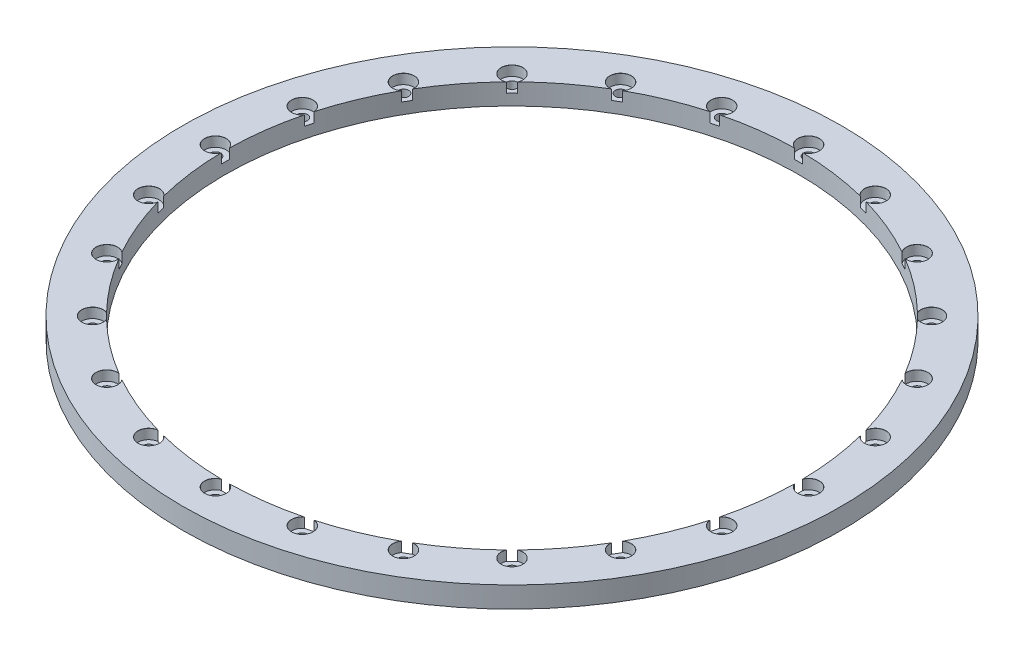
from build123d import *

# Parameters (mm, degrees)
SKETCH1_R                      = 100
SKETCH1_R_2                    = 87
BOSS_EXTRUDE1_DEPTH            = 6.35
CBORE_FOR_M3_SHCS1_AT_2_COUNT  = 2
CBORE_FOR_M3_SHCS1_AT_2_PITCH  = 23.4947146
CBORE_FOR_M3_SHCS1_AT_3_COUNT  = 2
CBORE_FOR_M3_SHCS1_AT_3_PITCH  = 46.587428118
CBORE_FOR_M3_SHCS1_AT_4_COUNT  = 2
CBORE_FOR_M3_SHCS1_AT_4_PITCH  = 68.883017826
CBORE_FOR_M3_SHCS1_AT_5_COUNT  = 2
CBORE_FOR_M3_SHCS1_AT_5_PITCH  = 90
CBORE_FOR_M3_SHCS1_AT_6_COUNT  = 2
CBORE_FOR_M3_SHCS1_AT_6_PITCH  = 109.577057222
CBORE_FOR_M3_SHCS1_AT_7_COUNT  = 2
CBORE_FOR_M3_SHCS1_AT_7_PITCH  = 127.279220614
CBORE_FOR_M3_SHCS1_AT_8_COUNT  = 2
CBORE_FOR_M3_SHCS1_AT_8_PITCH  = 142.803601252
CBORE_FOR_M3_SHCS1_AT_9_COUNT  = 2
CBORE_FOR_M3_SHCS1_AT_9_PITCH  = 155.884572681
CBORE_FOR_M3_SHCS1_AT_10_COUNT = 2
CBORE_FOR_M3_SHCS1_AT_10_PITCH = 166.298315852
CBORE_FOR_M3_SHCS1_AT_11_COUNT = 2
CBORE_FOR_M3_SHCS1_AT_11_PITCH = 173.866648732
CBORE_FOR_M3_SHCS1_AT_12_COUNT = 2
CBORE_FOR_M3_SHCS1_AT_12_PITCH = 178.460075047
CBORE_FOR_M3_SHCS1_AT_13_COUNT = 2
CBORE_FOR_M3_SHCS1_AT_13_PITCH = 180
CBORE_FOR_M3_SHCS1_AT_14_COUNT = 2
CBORE_FOR_M3_SHCS1_AT_14_PITCH = 178.460075047
CBORE_FOR_M3_SHCS1_AT_15_COUNT = 2
CBORE_FOR_M3_SHCS1_AT_15_PITCH = 173.866648732
CBORE_FOR_M3_SHCS1_AT_16_COUNT = 2
CBORE_FOR_M3_SHCS1_AT_16_PITCH = 166.298315852
CBORE_FOR_M3_SHCS1_AT_17_COUNT = 2
CBORE_FOR_M3_SHCS1_AT_17_PITCH = 155.884572681
CBORE_FOR_M3_SHCS1_AT_18_COUNT = 2
CBORE_FOR_M3_SHCS1_AT_18_PITCH = 142.803601252
CBORE_FOR_M3_SHCS1_AT_19_COUNT = 2
CBORE_FOR_M3_SHCS1_AT_19_PITCH = 127.279220614
CBORE_FOR_M3_SHCS1_AT_20_COUNT = 2
CBORE_FOR_M3_SHCS1_AT_20_PITCH = 109.577057222
CBORE_FOR_M3_SHCS1_AT_21_COUNT = 2
CBORE_FOR_M3_SHCS1_AT_21_PITCH = 90
CBORE_FOR_M3_SHCS1_AT_22_COUNT = 2
CBORE_FOR_M3_SHCS1_AT_22_PITCH = 68.883017826
CBORE_FOR_M3_SHCS1_AT_23_COUNT = 2
CBORE_FOR_M3_SHCS1_AT_23_PITCH = 46.587428118
CBORE_FOR_M3_SHCS1_AT_24_COUNT = 2
CBORE_FOR_M3_SHCS1_AT_24_PITCH = 23.4947146


with BuildPart() as part:
    # Sketch1 → Boss-Extrude1 (new body)
    with BuildSketch(Plane(origin=(0, 0, 0), x_dir=(1, 0, 0), z_dir=(0, 1, 0))):
        with Locations(Location((0, 0, 0), (0, 0, 270))):
            Circle(SKETCH1_R)
        with Locations(Location((0, 0, 0), (0, 0, 270))):
            Circle(SKETCH1_R_2, mode=Mode.SUBTRACT)
    extrude(amount=BOSS_EXTRUDE1_DEPTH)

    # Sketch3 → CBORE for M3 SHCS1 (revolve, cut)
    with BuildSketch(Plane(origin=(90, 6.35, 0), x_dir=(0, 0, 1), z_dir=(1, 0, 0))):
        Polygon((0, 0), (0, 6.35), (1.6, 6.35), (1.6, 3), (3.25, 3), (3.25, 0.025), (3.275, 0), align=None)
    cbore_for_m3_shcs1 = revolve(axis=Axis((90, 12.7, 0), (0, -1, 0)), mode=Mode.SUBTRACT)

    # CBORE for M3 SHCS1 at 2: CBORE for M3 SHCS1 ×2
    with Locations(*[Vector(-0.13052619222005138, 0, 0.9914448613738105) * (i * CBORE_FOR_M3_SHCS1_AT_2_PITCH) for i in range(1, CBORE_FOR_M3_SHCS1_AT_2_COUNT)]):
        add(cbore_for_m3_shcs1, mode=Mode.SUBTRACT)

    # CBORE for M3 SHCS1 at 3: CBORE for M3 SHCS1 ×2
    with Locations(*[Vector(-0.25881904510252074, 0, 0.9659258262890683) * (i * CBORE_FOR_M3_SHCS1_AT_3_PITCH) for i in range(1, CBORE_FOR_M3_SHCS1_AT_3_COUNT)]):
        add(cbore_for_m3_shcs1, mode=Mode.SUBTRACT)

    # CBORE for M3 SHCS1 at 4: CBORE for M3 SHCS1 ×2
    with Locations(*[Vector(-0.3826834323650899, 0, 0.9238795325112867) * (i * CBORE_FOR_M3_SHCS1_AT_4_PITCH) for i in range(1, CBORE_FOR_M3_SHCS1_AT_4_COUNT)]):
        add(cbore_for_m3_shcs1, mode=Mode.SUBTRACT)

    # CBORE for M3 SHCS1 at 5: CBORE for M3 SHCS1 ×2
    with Locations(*[Vector(-0.5000000000000001, 0, 0.8660254037844386) * (i * CBORE_FOR_M3_SHCS1_AT_5_PITCH) for i in range(1, CBORE_FOR_M3_SHCS1_AT_5_COUNT)]):
        add(cbore_for_m3_shcs1, mode=Mode.SUBTRACT)

    # CBORE for M3 SHCS1 at 6: CBORE for M3 SHCS1 ×2
    with Locations(*[Vector(-0.6087614290087208, 0, 0.7933533402912352) * (i * CBORE_FOR_M3_SHCS1_AT_6_PITCH) for i in range(1, CBORE_FOR_M3_SHCS1_AT_6_COUNT)]):
        add(cbore_for_m3_shcs1, mode=Mode.SUBTRACT)

    # CBORE for M3 SHCS1 at 7: CBORE for M3 SHCS1 ×2
    with Locations(*[Vector(-0.7071067811865476, 0, 0.7071067811865475) * (i * CBORE_FOR_M3_SHCS1_AT_7_PITCH) for i in range(1, CBORE_FOR_M3_SHCS1_AT_7_COUNT)]):
        add(cbore_for_m3_shcs1, mode=Mode.SUBTRACT)

    # CBORE for M3 SHCS1 at 8: CBORE for M3 SHCS1 ×2
    with Locations(*[Vector(-0.7933533402912352, 0, 0.6087614290087207) * (i * CBORE_FOR_M3_SHCS1_AT_8_PITCH) for i in range(1, CBORE_FOR_M3_SHCS1_AT_8_COUNT)]):
        add(cbore_for_m3_shcs1, mode=Mode.SUBTRACT)

    # CBORE for M3 SHCS1 at 9: CBORE for M3 SHCS1 ×2
    with Locations(*[Vector(-0.8660254037844387, 0, 0.5000000000000001) * (i * CBORE_FOR_M3_SHCS1_AT_9_PITCH) for i in range(1, CBORE_FOR_M3_SHCS1_AT_9_COUNT)]):
        add(cbore_for_m3_shcs1, mode=Mode.SUBTRACT)

    # CBORE for M3 SHCS1 at 10: CBORE for M3 SHCS1 ×2
    with Locations(*[Vector(-0.9238795325112868, 0, 0.38268343236508967) * (i * CBORE_FOR_M3_SHCS1_AT_10_PITCH) for i in range(1, CBORE_FOR_M3_SHCS1_AT_10_COUNT)]):
        add(cbore_for_m3_shcs1, mode=Mode.SUBTRACT)

    # CBORE for M3 SHCS1 at 11: CBORE for M3 SHCS1 ×2
    with Locations(*[Vector(-0.9659258262890683, 0, 0.2588190451025209) * (i * CBORE_FOR_M3_SHCS1_AT_11_PITCH) for i in range(1, CBORE_FOR_M3_SHCS1_AT_11_COUNT)]):
        add(cbore_for_m3_shcs1, mode=Mode.SUBTRACT)

    # CBORE for M3 SHCS1 at 12: CBORE for M3 SHCS1 ×2
    with Locations(*[Vector(-0.9914448613738104, 0, 0.1305261922200516) * (i * CBORE_FOR_M3_SHCS1_AT_12_PITCH) for i in range(1, CBORE_FOR_M3_SHCS1_AT_12_COUNT)]):
        add(cbore_for_m3_shcs1, mode=Mode.SUBTRACT)

    # CBORE for M3 SHCS1 at 13: CBORE for M3 SHCS1 ×2
    with Locations(*[(-i * CBORE_FOR_M3_SHCS1_AT_13_PITCH, 0, 0) for i in range(1, CBORE_FOR_M3_SHCS1_AT_13_COUNT)]):
        add(cbore_for_m3_shcs1, mode=Mode.SUBTRACT)

    # CBORE for M3 SHCS1 at 14: CBORE for M3 SHCS1 ×2
    with Locations(*[Vector(-0.9914448613738105, 0, -0.13052619222005152) * (i * CBORE_FOR_M3_SHCS1_AT_14_PITCH) for i in range(1, CBORE_FOR_M3_SHCS1_AT_14_COUNT)]):
        add(cbore_for_m3_shcs1, mode=Mode.SUBTRACT)

    # CBORE for M3 SHCS1 at 15: CBORE for M3 SHCS1 ×2
    with Locations(*[Vector(-0.9659258262890683, 0, -0.25881904510252074) * (i * CBORE_FOR_M3_SHCS1_AT_15_PITCH) for i in range(1, CBORE_FOR_M3_SHCS1_AT_15_COUNT)]):
        add(cbore_for_m3_shcs1, mode=Mode.SUBTRACT)

    # CBORE for M3 SHCS1 at 16: CBORE for M3 SHCS1 ×2
    with Locations(*[Vector(-0.9238795325112868, 0, -0.3826834323650895) * (i * CBORE_FOR_M3_SHCS1_AT_16_PITCH) for i in range(1, CBORE_FOR_M3_SHCS1_AT_16_COUNT)]):
        add(cbore_for_m3_shcs1, mode=Mode.SUBTRACT)

    # CBORE for M3 SHCS1 at 17: CBORE for M3 SHCS1 ×2
    with Locations(*[Vector(-0.8660254037844387, 0, -0.49999999999999994) * (i * CBORE_FOR_M3_SHCS1_AT_17_PITCH) for i in range(1, CBORE_FOR_M3_SHCS1_AT_17_COUNT)]):
        add(cbore_for_m3_shcs1, mode=Mode.SUBTRACT)

    # CBORE for M3 SHCS1 at 18: CBORE for M3 SHCS1 ×2
    with Locations(*[Vector(-0.7933533402912353, 0, -0.6087614290087204) * (i * CBORE_FOR_M3_SHCS1_AT_18_PITCH) for i in range(1, CBORE_FOR_M3_SHCS1_AT_18_COUNT)]):
        add(cbore_for_m3_shcs1, mode=Mode.SUBTRACT)

    # CBORE for M3 SHCS1 at 19: CBORE for M3 SHCS1 ×2
    with Locations(*[Vector(-0.7071067811865475, 0, -0.7071067811865476) * (i * CBORE_FOR_M3_SHCS1_AT_19_PITCH) for i in range(1, CBORE_FOR_M3_SHCS1_AT_19_COUNT)]):
        add(cbore_for_m3_shcs1, mode=Mode.SUBTRACT)

    # CBORE for M3 SHCS1 at 20: CBORE for M3 SHCS1 ×2
    with Locations(*[Vector(-0.6087614290087208, 0, -0.793353340291235) * (i * CBORE_FOR_M3_SHCS1_AT_20_PITCH) for i in range(1, CBORE_FOR_M3_SHCS1_AT_20_COUNT)]):
        add(cbore_for_m3_shcs1, mode=Mode.SUBTRACT)

    # CBORE for M3 SHCS1 at 21: CBORE for M3 SHCS1 ×2
    with Locations(*[Vector(-0.5000000000000003, 0, -0.8660254037844386) * (i * CBORE_FOR_M3_SHCS1_AT_21_PITCH) for i in range(1, CBORE_FOR_M3_SHCS1_AT_21_COUNT)]):
        add(cbore_for_m3_shcs1, mode=Mode.SUBTRACT)

    # CBORE for M3 SHCS1 at 22: CBORE for M3 SHCS1 ×2
    with Locations(*[Vector(-0.3826834323650898, 0, -0.9238795325112868) * (i * CBORE_FOR_M3_SHCS1_AT_22_PITCH) for i in range(1, CBORE_FOR_M3_SHCS1_AT_22_COUNT)]):
        add(cbore_for_m3_shcs1, mode=Mode.SUBTRACT)

    # CBORE for M3 SHCS1 at 23: CBORE for M3 SHCS1 ×2
    with Locations(*[Vector(-0.2588190451025208, 0, -0.9659258262890683) * (i * CBORE_FOR_M3_SHCS1_AT_23_PITCH) for i in range(1, CBORE_FOR_M3_SHCS1_AT_23_COUNT)]):
        add(cbore_for_m3_shcs1, mode=Mode.SUBTRACT)

    # CBORE for M3 SHCS1 at 24: CBORE for M3 SHCS1 ×2
    with Locations(*[Vector(-0.13052619222005138, 0, -0.9914448613738105) * (i * CBORE_FOR_M3_SHCS1_AT_24_PITCH) for i in range(1, CBORE_FOR_M3_SHCS1_AT_24_COUNT)]):
        add(cbore_for_m3_shcs1, mode=Mode.SUBTRACT)


solid = part.part
